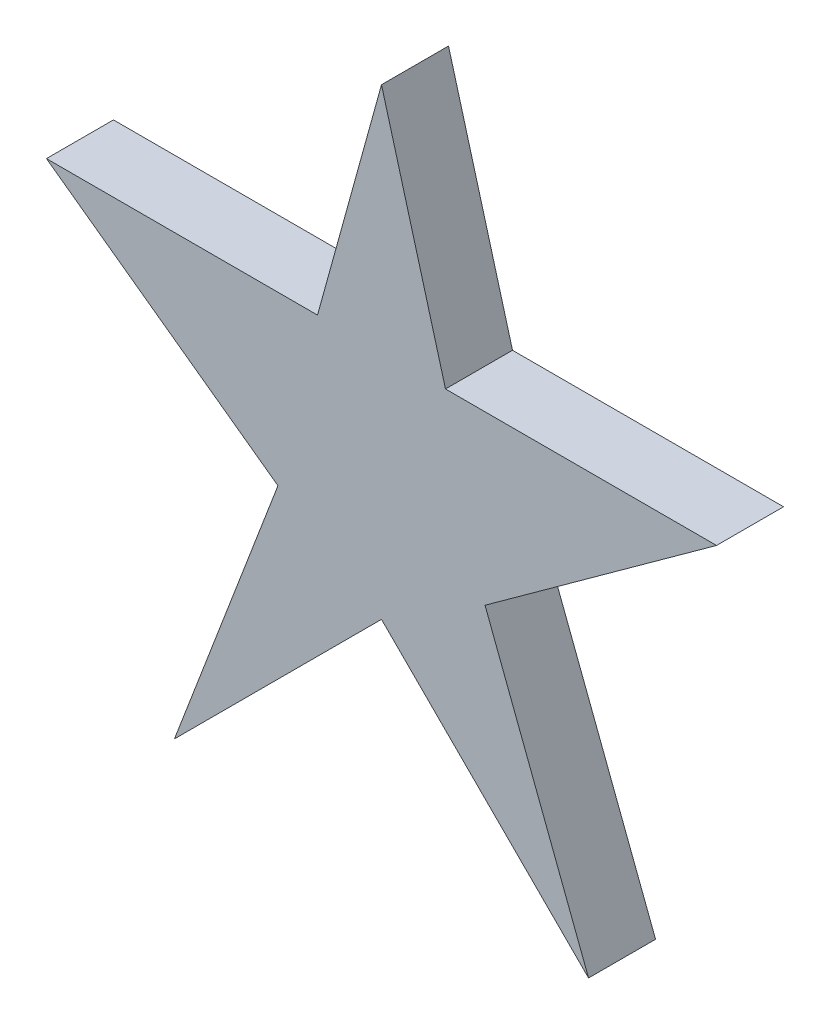
from build123d import *

# Parameters (mm, degrees)
EXTRUDE_1_DEPTH = 100


with BuildPart() as part:
    # 草图1 → 凸台-拉伸1 (new body)
    with BuildSketch(Plane.XY):
        Polygon((0, 500), (95.5, 154.5), (500, 154.5), (154.5, -95.5), (309, -500), (0, -191), (-309, -500), (-154.5, -95.5), (-500, 154.5), (-95.5, 154.5), align=None)
    extrude(amount=EXTRUDE_1_DEPTH)


solid = part.part
